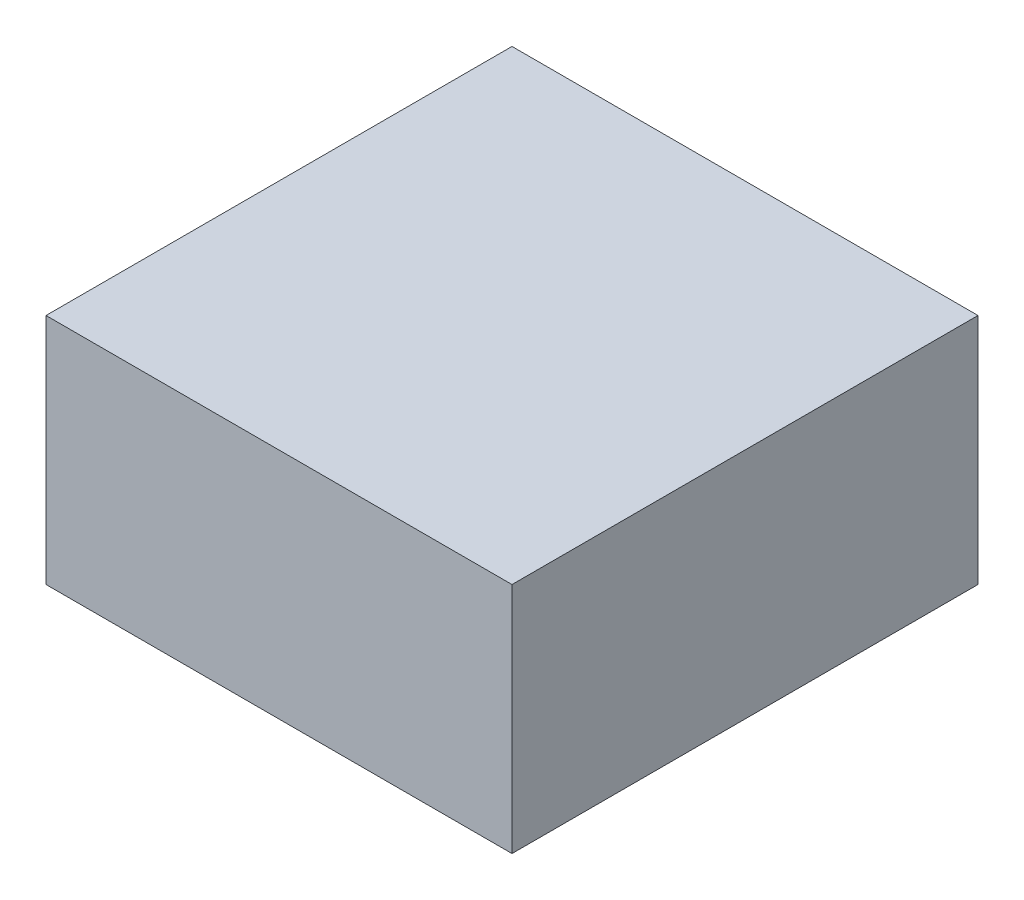
from build123d import *

# Parameters (mm, degrees)
SKETCH1_W           = 3000
SKETCH1_H           = 3000
BOSS_EXTRUDE2_DEPTH = 750


with BuildPart() as part:
    # Sketch1 → Boss-Extrude2 (new, symmetric)
    with BuildSketch(Plane(origin=(0, 0, 0), x_dir=(1, 0, 0), z_dir=(0, 1, 0))):
        Rectangle(SKETCH1_W, SKETCH1_H)
    extrude(amount=BOSS_EXTRUDE2_DEPTH, both=True)


solid = part.part
